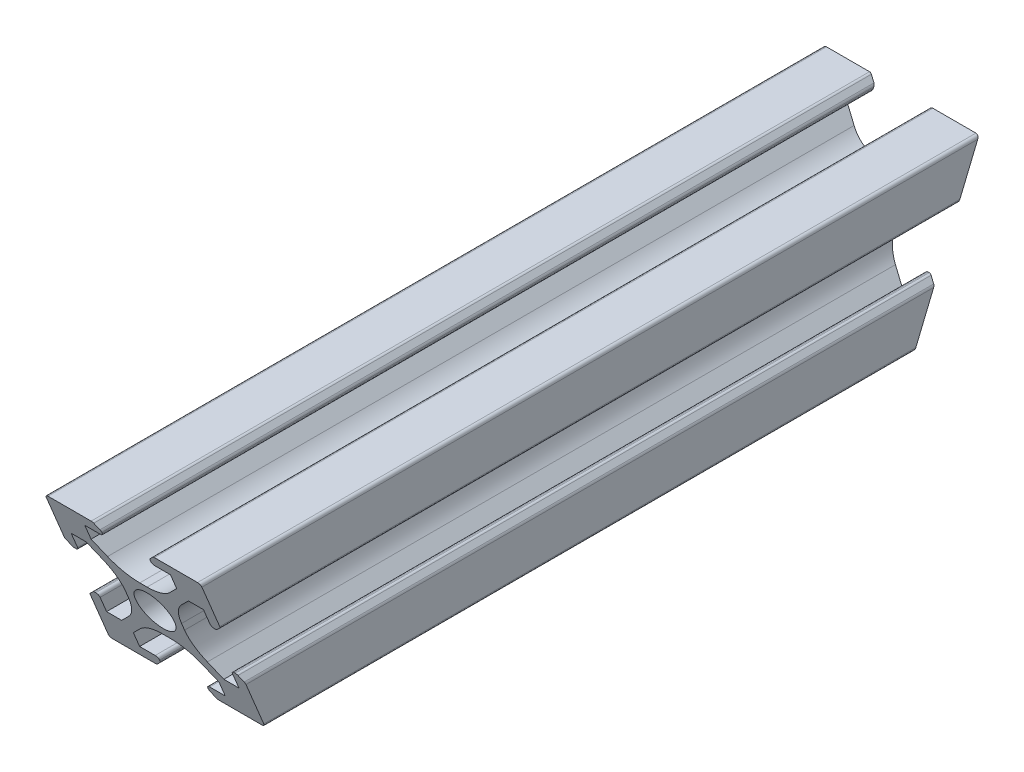
from build123d import *

# Parameters (mm, degrees)
RESSALTO_EXTRUS_O1_DEPTH = 100
PADR_OCIRCULAR1_COUNT    = 4
FILETE1_R                = 0.4
CUT_EXTRUDE1_DEPTH       = 103.46950766


with BuildPart() as part:
    # Esboço1 → Ressalto-extrusão1 (new body)
    with BuildSketch(Plane.XY):
        with BuildLine():
            ThreePointArc((-9.317157288, 3.217157288), (-9.187387948, 3.130448187), (-9.034314575, 3.1))
            Line((-9.034314575, 3.1), (-8.9, 3.1))
            ThreePointArc((-8.9, 3.1), (-8.617157288, 3.217157288), (-8.5, 3.5))
            Line((-8.5, 3.5), (-8.5, 5.5))
            Line((-8.5, 5.5), (-6.560660172, 5.5))
            Line((-6.560660172, 5.5), (-5.064466094, 4.003805922))
            ThreePointArc((-5.064466094, 4.003805922), (-3.980602337, 2.381689178), (-3.6, 0.468272016))
            Line((-3.6, 0.468272016), (-3.6, 0))
            Line((-3.6, 0), (-2.5, 0))
            ThreePointArc((-2.5, 0), (-1.767766953, 1.767766953), (0, 2.5))
            Line((0, 2.5), (0, 3.6))
            Line((0, 3.6), (-0.468272016, 3.6))
            ThreePointArc((-0.468272016, 3.6), (-2.381689178, 3.980602337), (-4.003805922, 5.064466094))
            Line((-4.003805922, 5.064466094), (-5.5, 6.560660172))
            Line((-5.5, 6.560660172), (-5.5, 8.5))
            Line((-5.5, 8.5), (-3.5, 8.5))
            ThreePointArc((-3.5, 8.5), (-3.217157288, 8.617157288), (-3.1, 8.9))
            Line((-3.1, 8.9), (-3.1, 9.034314575))
            ThreePointArc((-3.1, 9.034314575), (-3.130448187, 9.187387948), (-3.217157288, 9.317157288))
            Line((-3.217157288, 9.317157288), (-3.782842712, 9.882842712))
            ThreePointArc((-3.782842712, 9.882842712), (-3.912612052, 9.969551813), (-4.065685425, 10))
            Line((-4.065685425, 10), (-10, 10))
            Line((-10, 10), (-10, 4.065685425))
            ThreePointArc((-10, 4.065685425), (-9.969551813, 3.912612052), (-9.882842712, 3.782842712))
            Line((-9.882842712, 3.782842712), (-9.317157288, 3.217157288))
        make_face()
    ressalto_extrus_o1 = extrude(amount=RESSALTO_EXTRUS_O1_DEPTH)

    # PadrãoCircular1: Ressalto-extrusão1 ×4 about axis
    padr_ocircular1_axis = Axis((0, 0, 0), (0, 0, 1))
    for i in range(1, PADR_OCIRCULAR1_COUNT):
        add(ressalto_extrus_o1.rotate(padr_ocircular1_axis, i * 360 / PADR_OCIRCULAR1_COUNT))

    # Filete1
    filete1_edges = [part.edges().sort_by_distance(p)[0] for p in [
        (10, -10, 50),
        (10, 10, 50),
        (-10, 10, 50),
        (-10, -10, 50),
    ]]
    fillet(filete1_edges, radius=FILETE1_R)

    # Sketch1 → Cut-Extrude1 (cut, through all)
    with BuildSketch(Plane.ZY.offset(10)):
        Polygon((2.45807358, 4.065685425), (0, 4.065685425), (0, -10), (8.284271247, -10), align=None)
        Polygon((0.165685425, 9.6), (0, 9.6), (0, 4.065685425), (2.45807358, 4.065685425), align=None)
        Polygon((100, 9.6), (99.834314575, 9.6), (97.54192642, 4.065685425), (100, 4.065685425), align=None)
        Polygon((100, 4.065685425), (97.54192642, 4.065685425), (91.715728753, -10), (100, -10), (100, -9.6), align=None)
        Polygon((100, 10), (99.834314575, 9.6), (100, 9.6), align=None)
        Polygon((0.165685425, 9.6), (0, 10), (0, 9.6), align=None)
    extrude(amount=-CUT_EXTRUDE1_DEPTH, mode=Mode.SUBTRACT)


solid = part.part
